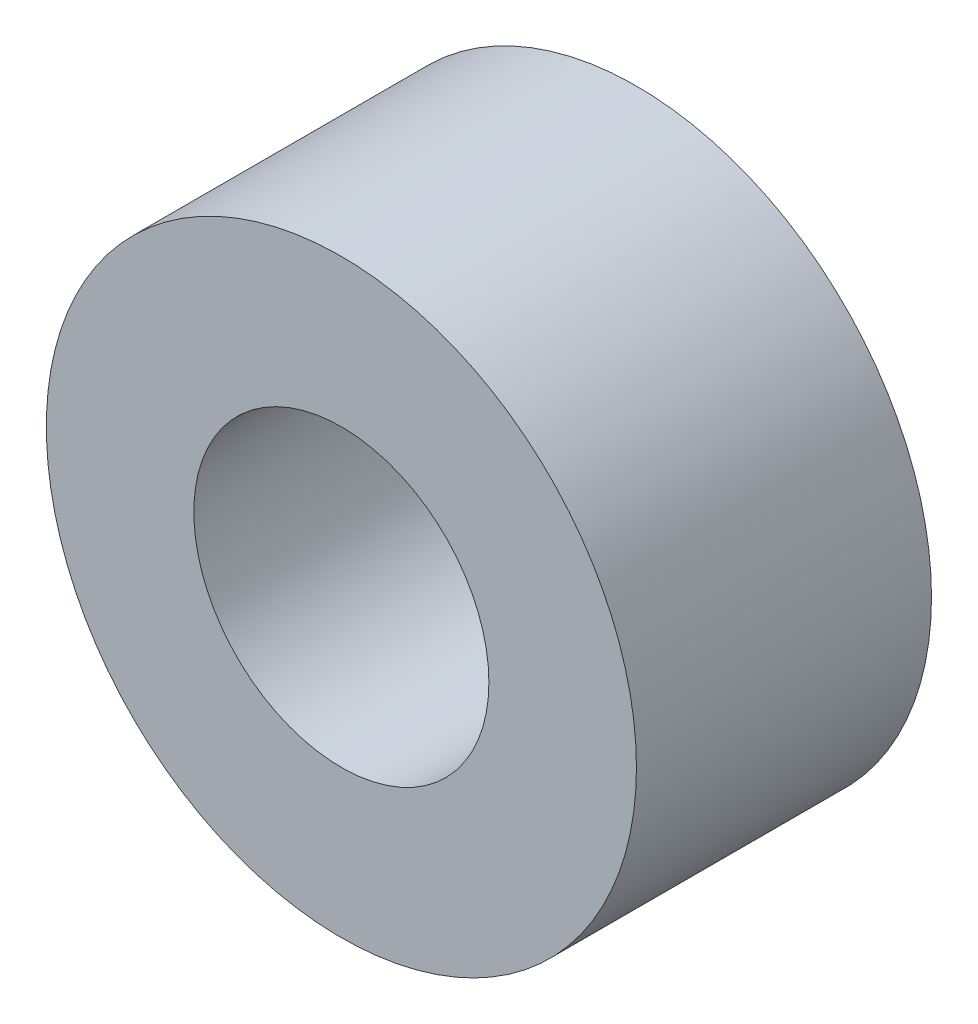
from build123d import *

# Parameters (mm, degrees)
SKETCH1_R           = 3.175
SKETCH1_R_2         = 1.5875
BOSS_EXTRUDE1_DEPTH = 1.5875


with BuildPart() as part:
    # Sketch1 → Boss-Extrude1 (new, symmetric)
    with BuildSketch(Plane.XY):
        with Locations((-43.160110524, -91.756932926)):
            Circle(SKETCH1_R)
        with Locations((-43.160110524, -91.756932926)):
            Circle(SKETCH1_R_2, mode=Mode.SUBTRACT)
    extrude(amount=BOSS_EXTRUDE1_DEPTH, both=True)


solid = part.part
